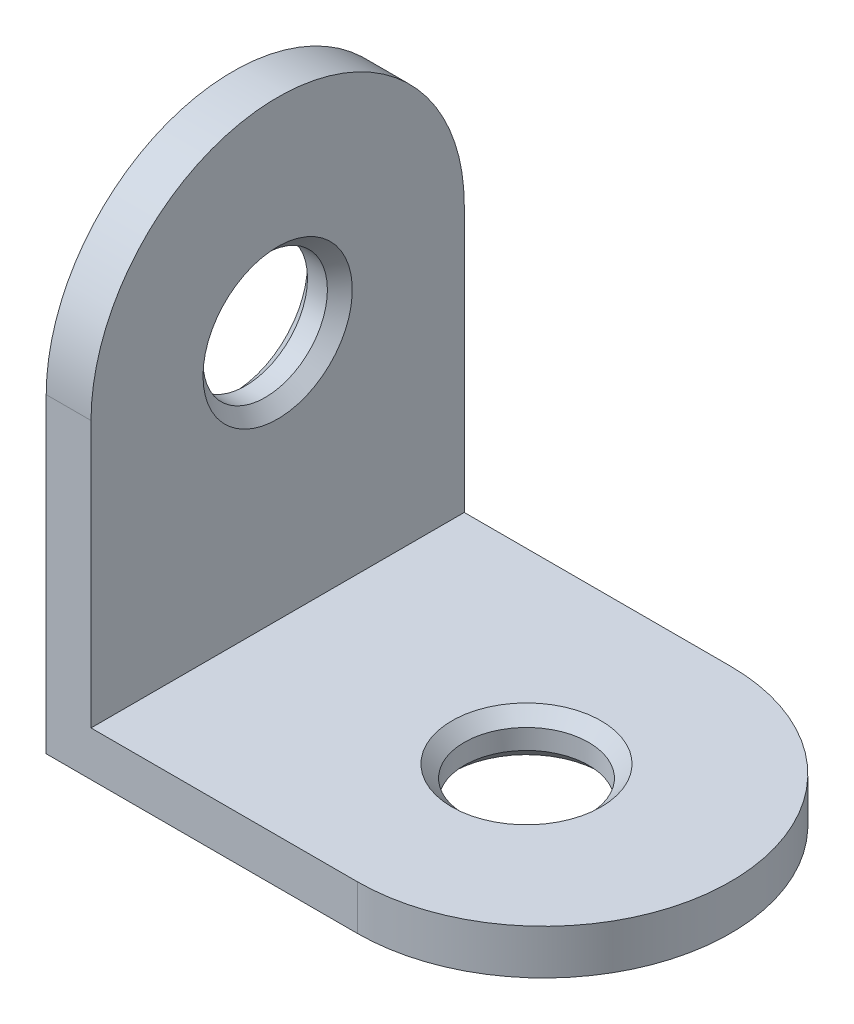
from build123d import *

# Parameters (mm, degrees)
BOSS_EXTRUDE1_DEPTH = 15
FILLET1_RADIUS      = 7.5
FILLET1_LENGTH      = 1.8
FILLET2_RADIUS      = 7.5
FILLET2_LENGTH      = 1.8
SKETCH3_R           = 2.5
CUT_EXTRUDE1_DEPTH  = 10
SKETCH2_R           = 2.5
CUT_EXTRUDE2_DEPTH  = 10
CHAMFER1_SIZE       = 0.5


with BuildPart() as part:
    # Sketch1 → Boss-Extrude1 (new body)
    with BuildSketch(Plane.XY):
        Polygon((0, 0), (20, 0), (20, 1.8), (1.8, 1.8), (1.8, 20), (0, 20), align=None)
    extrude(amount=BOSS_EXTRUDE1_DEPTH)

    # Fillet1: full round fillet: the end face becomes a half cylinder, R = half its width
    fillet1_face = Plane((0.9, 20, 7.5), x_dir=(1, 0, 0), z_dir=(0, 1, 0))  # on the end face: x along it, z out of the body
    fillet1_slab = fillet1_face.offset(-FILLET1_RADIUS / 2) * Box(FILLET1_LENGTH, 2 * FILLET1_RADIUS, FILLET1_RADIUS, mode=Mode.PRIVATE)  # the body's end, R deep
    fillet1_round = Plane((0.9, 12.5, 7.5), x_dir=(0, 1, 0), z_dir=(1, 0, 0)) * Cylinder(FILLET1_RADIUS, FILLET1_LENGTH, mode=Mode.PRIVATE)  # its axis R under the face
    add(fillet1_slab - fillet1_round, mode=Mode.SUBTRACT)

    # Fillet2: full round fillet: the end face becomes a half cylinder, R = half its width
    fillet2_face = Plane((20, 0.9, 7.5), x_dir=(0, -1, 0), z_dir=(1, 0, 0))  # on the end face: x along it, z out of the body
    fillet2_slab = fillet2_face.offset(-FILLET2_RADIUS / 2) * Box(FILLET2_LENGTH, 2 * FILLET2_RADIUS, FILLET2_RADIUS, mode=Mode.PRIVATE)  # the body's end, R deep
    fillet2_round = Plane((12.5, 0.9, 7.5), x_dir=(1, 0, 0), z_dir=(0, -1, 0)) * Cylinder(FILLET2_RADIUS, FILLET2_LENGTH, mode=Mode.PRIVATE)  # its axis R under the face
    add(fillet2_slab - fillet2_round, mode=Mode.SUBTRACT)

    # Sketch3 → Cut-Extrude1 (cut)
    with BuildSketch(Plane(origin=(0, 1.8, 0), x_dir=(1, 0, 0), z_dir=(0, 1, 0))):
        with Locations(Location((11.8, -7.5, 0), (0, 0, 180))):
            Circle(SKETCH3_R)
    extrude(amount=-CUT_EXTRUDE1_DEPTH, mode=Mode.SUBTRACT)

    # Sketch2 → Cut-Extrude2 (cut)
    with BuildSketch(Plane(origin=(1.8, 0, 0), x_dir=(0, 0, -1), z_dir=(1, 0, 0))):
        with Locations((-7.5, 11.8)):
            Circle(SKETCH2_R)
    extrude(amount=-CUT_EXTRUDE2_DEPTH, mode=Mode.SUBTRACT)

    # Chamfer1
    chamfer1_edges = [part.edges().sort_by_distance(p)[0] for p in [
        (14.3, 0, 7.5),
        (14.3, 1.8, 7.5),
        (0, 11.8, 10),
        (1.8, 11.8, 10),
    ]]
    chamfer(chamfer1_edges, length=CHAMFER1_SIZE)


solid = part.part
